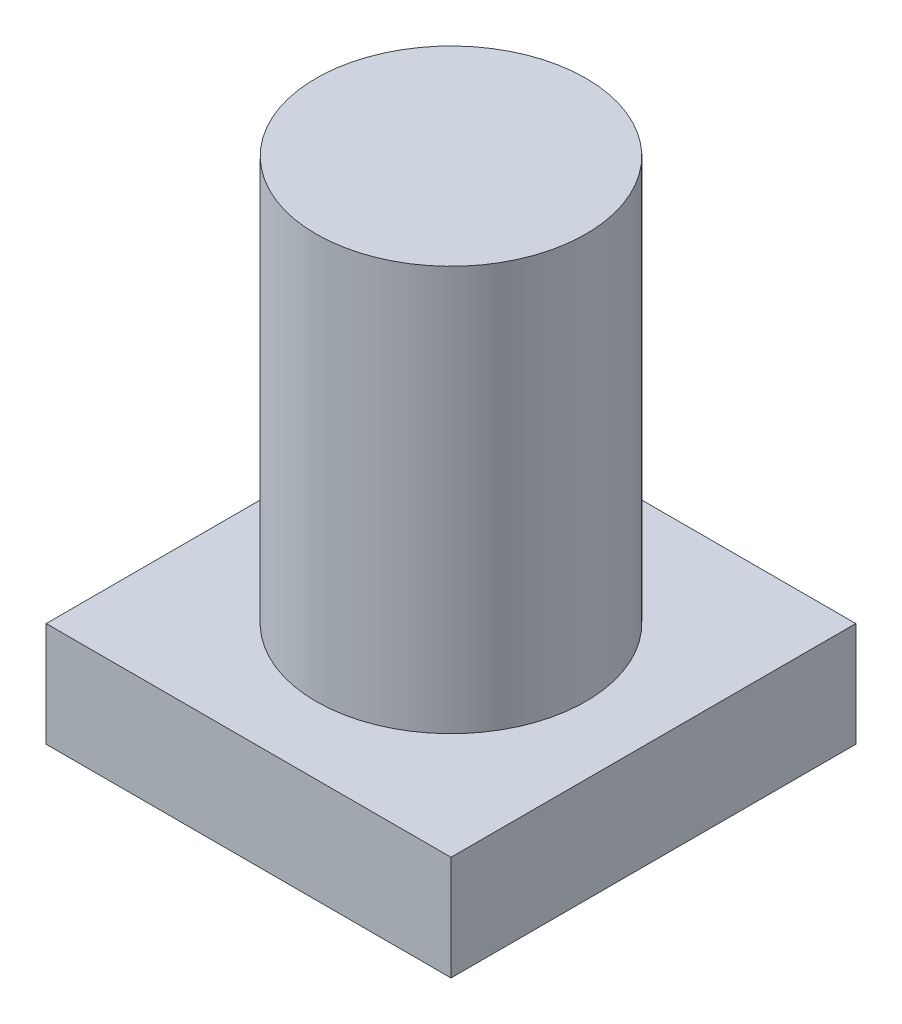
from build123d import *

# Parameters (mm, degrees)
SKETCH_1_W      = 12
SKETCH_1_H      = 12
EXTRUDE_1_DEPTH = 3.1
SKETCH_2_R      = 4
EXTRUDE_2_DEPTH = 12


with BuildPart() as part:
    # 草图1 → 拉伸1 (new body)
    with BuildSketch(Plane(origin=(0, 0, 0), x_dir=(1, 0, 0), z_dir=(0, 1, 0))):
        Rectangle(SKETCH_1_W, SKETCH_1_H)
    extrude(amount=EXTRUDE_1_DEPTH)

    # 草图2 → 拉伸2 (add)
    with BuildSketch(Plane(origin=(0, 3.1, 0), x_dir=(-1, 0, 0), z_dir=(0, 1, 0))):
        with Locations(Location((0, 0, 0), (0, 0, 90))):
            Circle(SKETCH_2_R)
    extrude(amount=EXTRUDE_2_DEPTH)


solid = part.part
